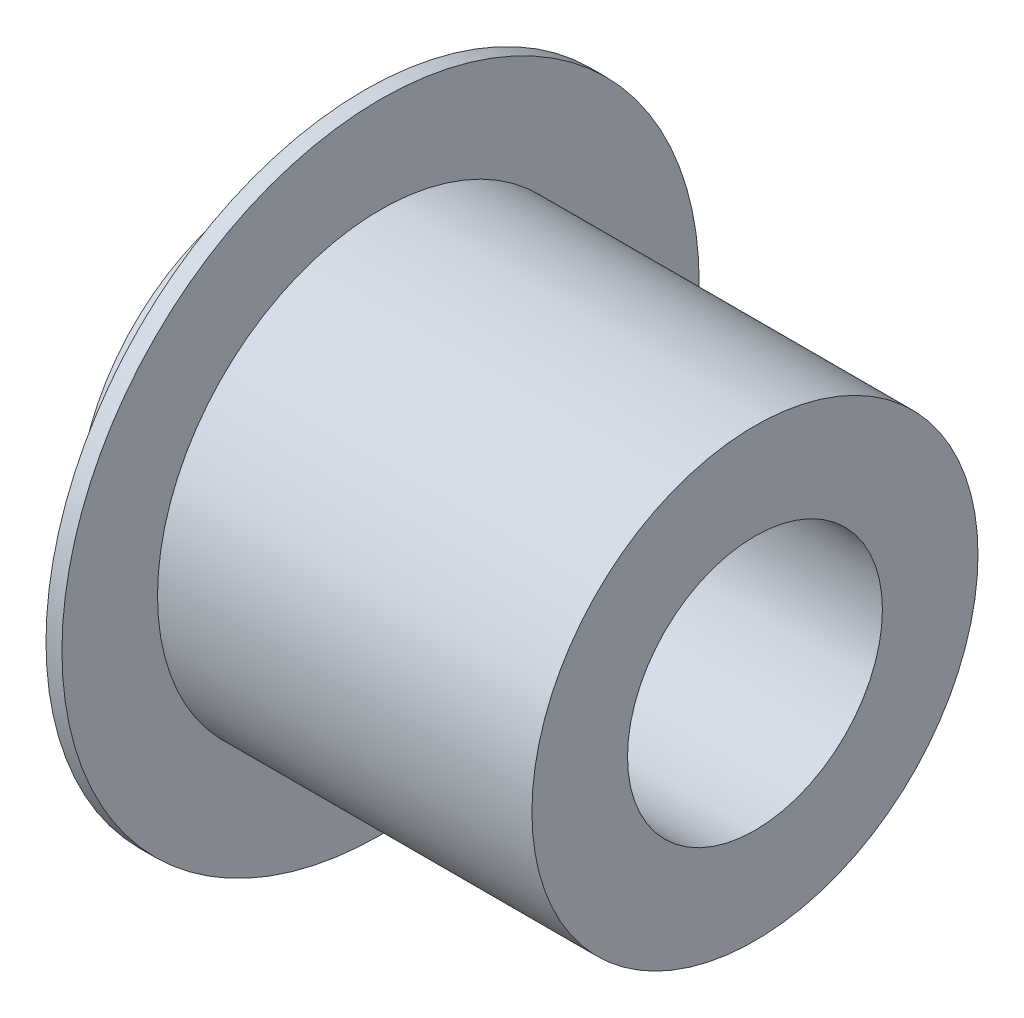
from build123d import *


with BuildPart() as part:
    # 草图1 → 旋转1 (revolve)
    with BuildSketch(Plane.XY, mode=Mode.PRIVATE) as revolve_1_sk:
        Polygon((0, 8), (0, 12), (1, 12), (3, 14), (6, 14), (6, 20), (7, 20), (7, 14), (30.5, 14), (30.5, 8), align=None)
    revolve(revolve_1_sk.sketch.rotate(Axis((-25.37132476, 0, 0), (1, 0, 0)), 90), axis=Axis((-25.37132476, 0, 0), (1, 0, 0)))


solid = part.part
